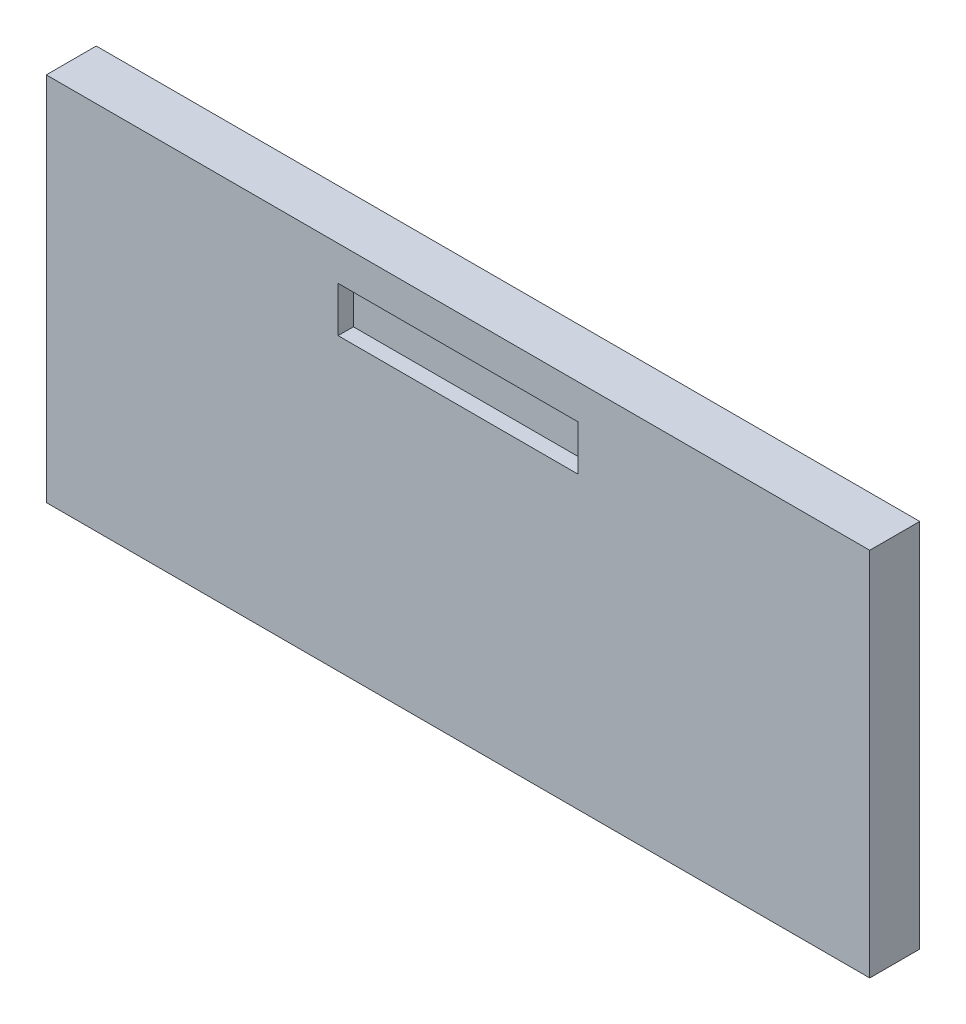
from build123d import *

# Parameters (mm, degrees)
STORE_KLAPE_KASET_KATI_ON_PU_1_START = 1
SKETCH1_W                            = 618
SKETCH1_H                            = 278
STORE_KLAPE_KASET_KATI_ON_PU_1_DEPTH = 37.5
STORE_KLAPE_KASET_KATI_ON_PU_2_START = 27
SKETCH2_W                            = 180
SKETCH2_H                            = 34
STORE_KLAPE_KASET_KATI_ON_PU_2_DEPTH = 14


with BuildPart() as part:
    # Sketch1 → STORE_klape_kaset_kati_on_pu_1 (new body)
    with BuildSketch(Plane.XY.offset(STORE_KLAPE_KASET_KATI_ON_PU_1_START)):
        with Locations((378, 545)):
            Rectangle(SKETCH1_W, SKETCH1_H)
    extrude(amount=STORE_KLAPE_KASET_KATI_ON_PU_1_DEPTH)

    # Sketch2 → STORE_klape_kaset_kati_on_pu_2 (cut)
    with BuildSketch(Plane.XY.offset(STORE_KLAPE_KASET_KATI_ON_PU_2_START)):
        with Locations((378, 641)):
            Rectangle(SKETCH2_W, SKETCH2_H)
    extrude(amount=STORE_KLAPE_KASET_KATI_ON_PU_2_DEPTH, mode=Mode.SUBTRACT)


solid = part.part
